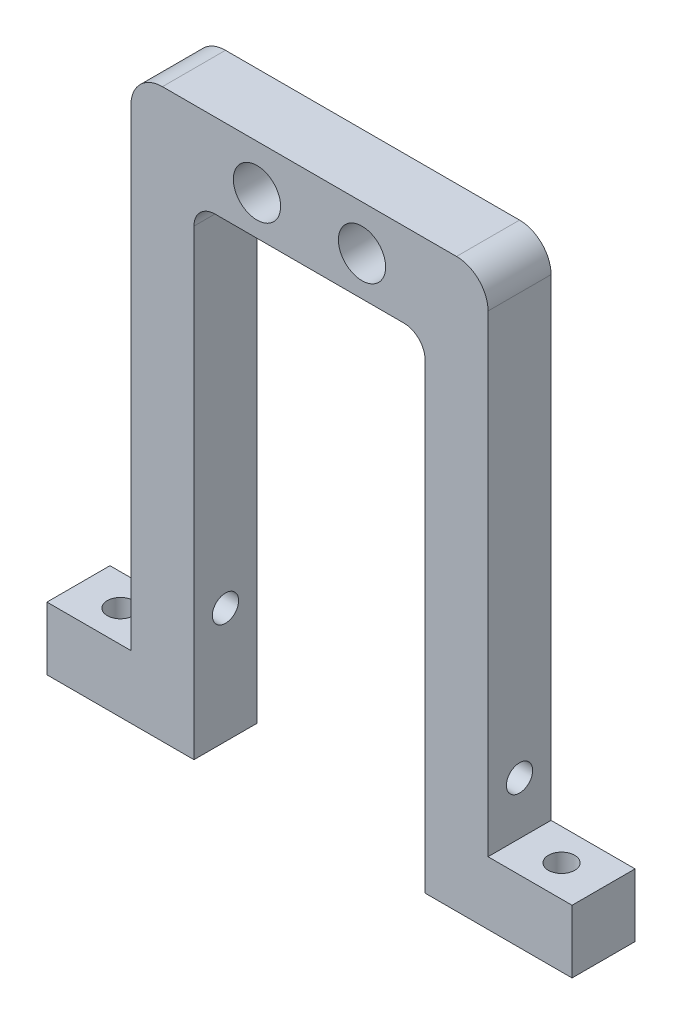
from build123d import *

# Parameters (mm, degrees)
SKETCH_1_W             = 34
SKETCH_1_H             = 54
SKETCH_1_R             = 2.25
EXTRUDE_1_DEPTH        = 6
SKETCH_4_W             = 8
SKETCH_4_H             = 6
EXTRUDE_2_DEPTH        = 6
SKETCH_2_W             = 22
SKETCH_2_H             = 46
CUT_EXTRUDE_1_DEPTH    = 10
FILLET_1_R             = 3
FILLET_2_R             = 2
HOLE_WIZARD_M3_1_D     = 2.5
HOLE_WIZARD_M3_1_DEPTH = 7.5
HOLE_WIZARD_M3_1_TIP   = 0.751075774
HOLE_WIZARD_M3_2_D     = 2.5
HOLE_WIZARD_M3_2_DEPTH = 101.5
HOLE_WIZARD_M3_2_TIP   = 0.751075774


with BuildPart() as part:
    # 草图1 → 凸台-拉伸1 (new body)
    with BuildSketch(Plane.XY):
        Rectangle(SKETCH_1_W, SKETCH_1_H)
        with Locations((-5, 22.75)):
            Circle(SKETCH_1_R, mode=Mode.SUBTRACT)
        with Locations(Location((5, 22.75, 0), (0, 0, 180))):
            Circle(SKETCH_1_R, mode=Mode.SUBTRACT)
    extrude(amount=EXTRUDE_1_DEPTH)

    # 草图4 → 凸台-拉伸2 (add)
    with BuildSketch(Plane.XY):
        with Locations((21, -24)):
            Rectangle(SKETCH_4_W, SKETCH_4_H)
        with Locations((-21, -24)):
            Rectangle(SKETCH_4_W, SKETCH_4_H)
    extrude(amount=EXTRUDE_2_DEPTH)

    # 草图2 → 切除-拉伸1 (cut)
    with BuildSketch(Plane.XY.offset(6)):
        with Locations((0, -4)):
            Rectangle(SKETCH_2_W, SKETCH_2_H)
    extrude(amount=-CUT_EXTRUDE_1_DEPTH, mode=Mode.SUBTRACT)

    # 圆角1
    fillet_1_edges = [part.edges().sort_by_distance(p)[0] for p in [
        (-17, 27, 3),
        (17, 27, 3),
    ]]
    fillet(fillet_1_edges, radius=FILLET_1_R)

    # 圆角2
    fillet_2_edges = [part.edges().sort_by_distance(p)[0] for p in [
        (-11, 19, 3),
        (11, 19, 3),
    ]]
    fillet(fillet_2_edges, radius=FILLET_2_R)

    # M3 螺纹孔1
    with Locations(Plane(origin=(0, -21, 0), x_dir=(1, 0, 0), z_dir=(0, 1, 0))):
        with Locations((-21, -3), (21, -3)):
            Hole(HOLE_WIZARD_M3_1_D / 2, depth=HOLE_WIZARD_M3_1_DEPTH)
            with Locations((0, 0, -(HOLE_WIZARD_M3_1_DEPTH + HOLE_WIZARD_M3_1_TIP / 2))):  # 118° drill point
                Cone(0, HOLE_WIZARD_M3_1_D / 2, HOLE_WIZARD_M3_1_TIP, mode=Mode.SUBTRACT)

    # M3 螺纹孔2
    with Locations(Plane.ZY.offset(17)):
        with Locations((3, -16)):
            Hole(HOLE_WIZARD_M3_2_D / 2, depth=HOLE_WIZARD_M3_2_DEPTH)
            with Locations((0, 0, -(HOLE_WIZARD_M3_2_DEPTH + HOLE_WIZARD_M3_2_TIP / 2))):  # 118° drill point
                Cone(0, HOLE_WIZARD_M3_2_D / 2, HOLE_WIZARD_M3_2_TIP, mode=Mode.SUBTRACT)


solid = part.part
